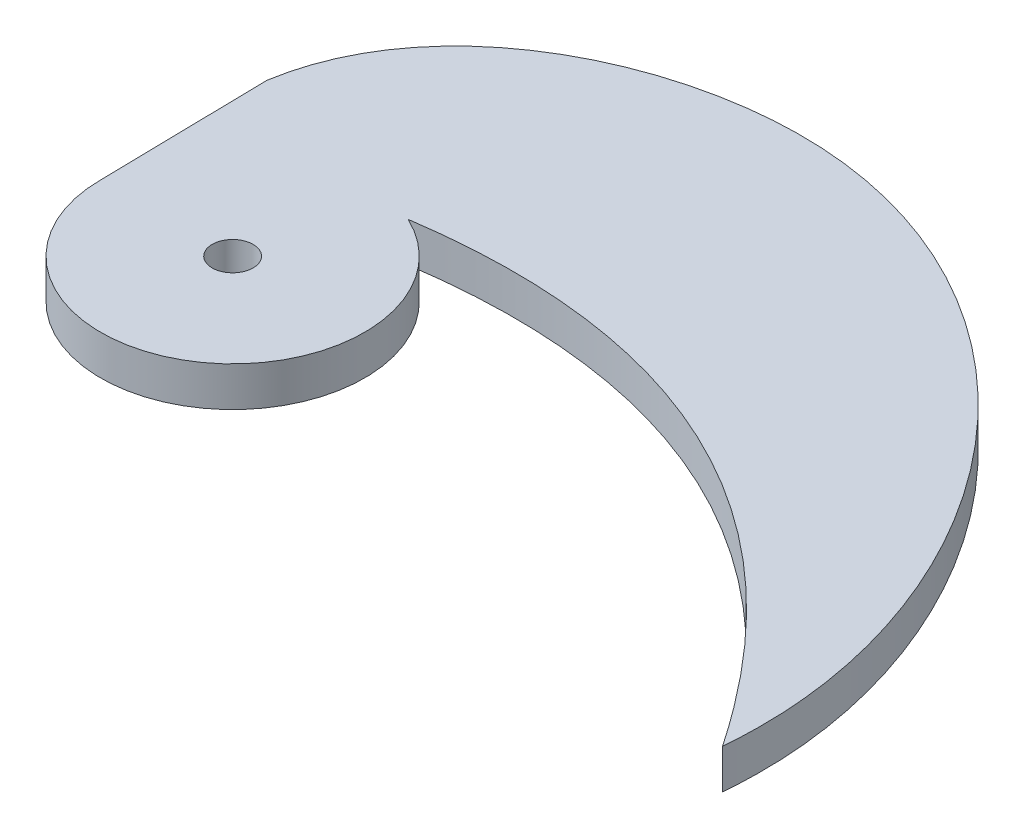
from build123d import *

# Parameters (mm, degrees)
SKETCH1_R           = 3.1
BOSS_EXTRUDE1_DEPTH = 6


with BuildPart() as part:
    # Sketch1 → Boss-Extrude1 (new body)
    with BuildSketch(Plane(origin=(0, 0, 0), x_dir=(1, 0, 0), z_dir=(0, 1, 0))):
        with BuildLine():
            ThreePointArc((-20, 0), (10.745992167, -16.867828916), (8.452365235, 18.126155741))
            add(Edge.make_bspline(
                [(8.452365235, 18.126155741), (65.014942837, 26.513222836), (101.42221176, -27.175999736)],
                knots=[0, 0, 0, 1, 1, 1], degree=2))
            add(Edge.make_bspline(
                [(-20.478801126, 25.658824893), (-19.369315981, 32.640094211), (-9.555820546, 50.988671143), (57.295225174, 74.584391164), (105.094597494, 12.854902244), (101.42221176, -27.175999736)],
                knots=[0.052355051, 0.052355051, 0.052355051, 0.052355051, 0.15626575, 0.372181463, 1, 1, 1, 1], degree=3))
            Line((-20.478801126, 25.658824893), (-20, 0))
        make_face()
        with Locations(Location((0, 0, 0), (0, 0, 270))):
            Circle(SKETCH1_R, mode=Mode.SUBTRACT)
    extrude(amount=BOSS_EXTRUDE1_DEPTH)


solid = part.part
